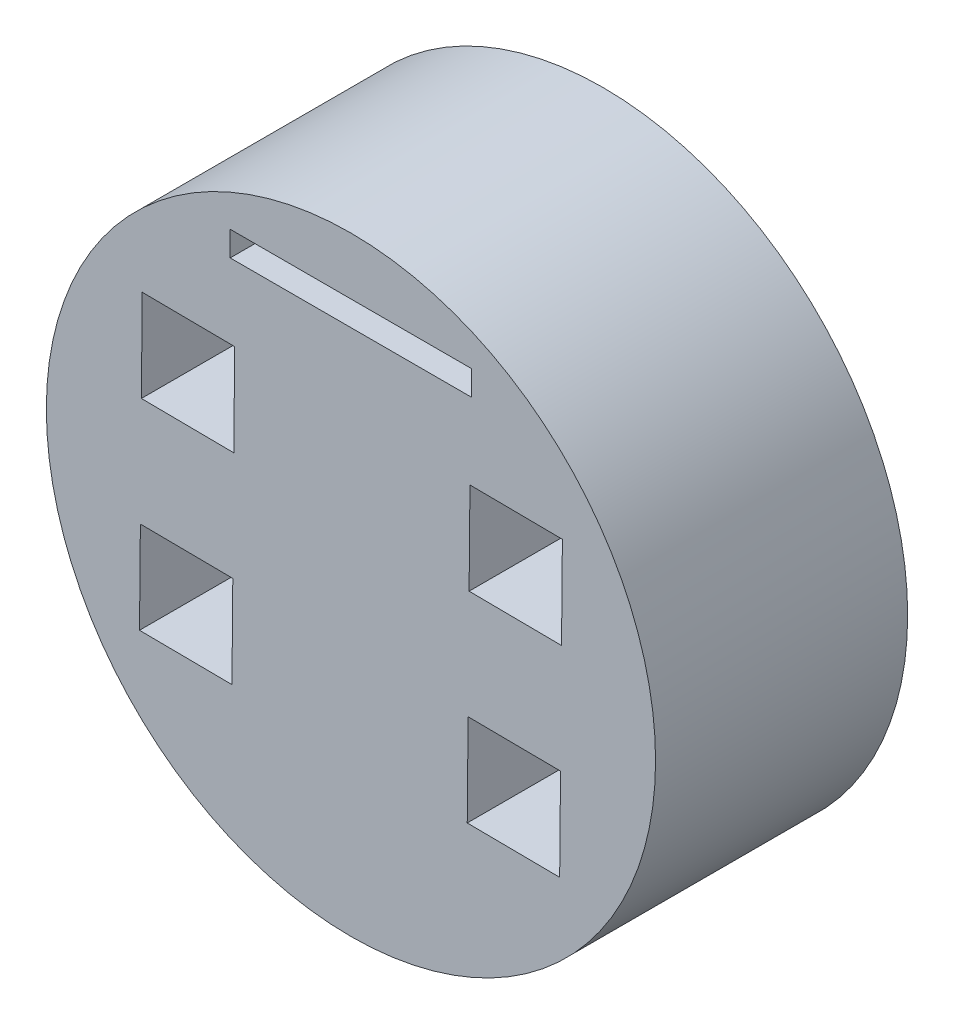
from build123d import *

# Parameters (mm, degrees)
SKETCH1_R           = 92.075
BOSS_EXTRUDE1_DEPTH = 76.2
CUT_EXTRUDE3_DEPTH  = 76.2
SKETCH8_W           = 73
SKETCH8_H           = 7.5
CUT_EXTRUDE4_DEPTH  = 76.2


with BuildPart() as part:
    # Sketch1 → Boss-Extrude1 (new body)
    with BuildSketch(Plane.XY):
        with Locations(Location((0, 0, 0), (0, 0, 180))):
            Circle(SKETCH1_R)
    extrude(amount=BOSS_EXTRUDE1_DEPTH)

    # Sketch7 → Cut-Extrude3 (cut)
    with BuildSketch(Plane(origin=(0, 0, 0), x_dir=(-1, 0, 0), z_dir=(0, 0, -1))):
        Polygon((35.148231052, 44.776310186), (35.406105201, 16.837500245), (63.344915142, 17.095374394), (63.087040993, 45.034184335), align=None)
        Polygon((63.649675499, -15.923219173), (35.710865558, -16.181093322), (35.968739707, -44.119903263), (63.907549648, -43.862029114), align=None)
        Polygon((-35.148231052, -44.776310186), (-35.406105201, -16.837500245), (-63.344915142, -17.095374394), (-63.087040993, -45.034184335), align=None)
        Polygon((-63.649675499, 15.923219173), (-35.710865558, 16.181093322), (-35.968739707, 44.119903263), (-63.907549648, 43.862029114), align=None)
    extrude(amount=-CUT_EXTRUDE3_DEPTH, mode=Mode.SUBTRACT)

    # Sketch8 → Cut-Extrude4 (cut)
    with BuildSketch(Plane.XY.offset(76.2)):
        with Locations((0, 71.06)):
            Rectangle(SKETCH8_W, SKETCH8_H)
    extrude(amount=-CUT_EXTRUDE4_DEPTH, mode=Mode.SUBTRACT)


solid = part.part
